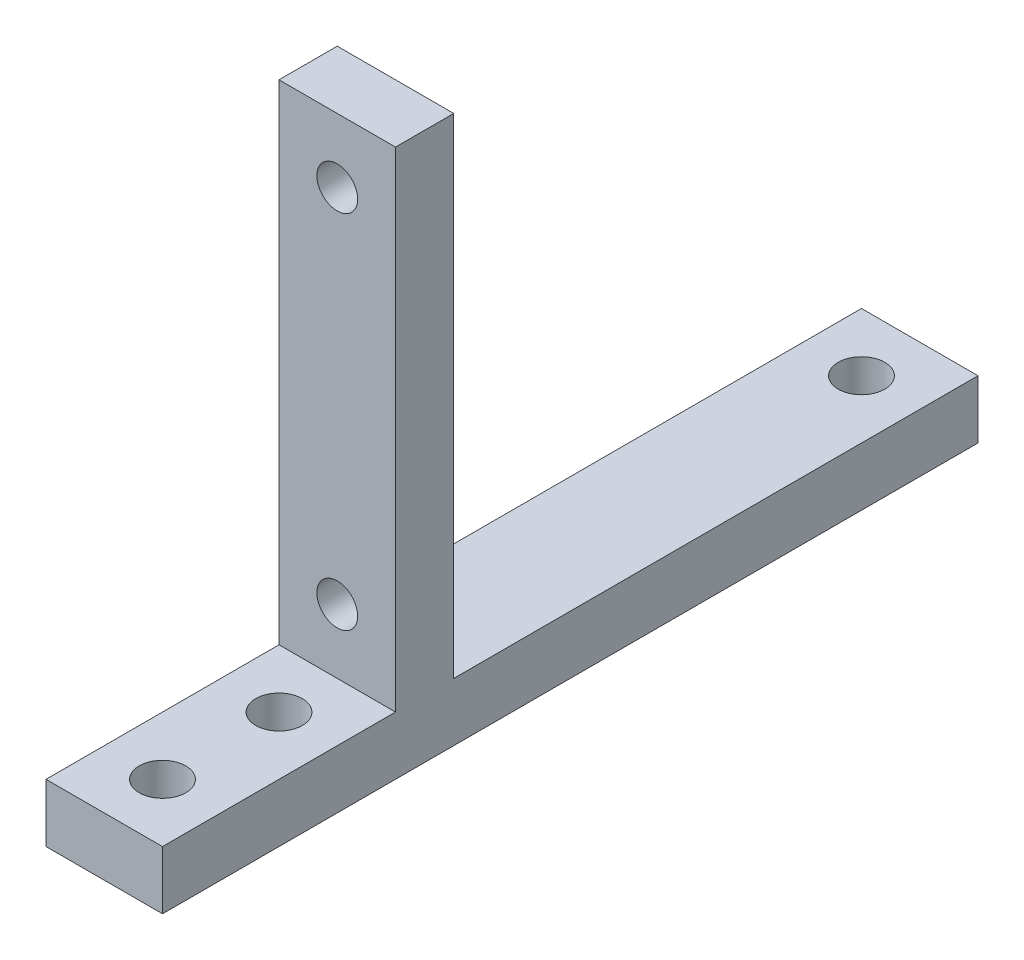
from build123d import *

# Parameters (mm, degrees)
ESBO_O1_W                = 10
ESBO_O1_H                = 42
ESBO_O1_R                = 1.75
RESSALTO_EXTRUS_O1_DEPTH = 5
ESBO_O2_W                = 10
ESBO_O2_H                = 70
ESBO_O2_R                = 2
RESSALTO_EXTRUS_O2_DEPTH = 5


with BuildPart() as part:
    # Esboço1 → Ressalto-extrusão1 (new body)
    with BuildSketch(Plane.XY):
        Rectangle(ESBO_O1_W, ESBO_O1_H)
        with Locations((0, 15.5)):
            Circle(ESBO_O1_R, mode=Mode.SUBTRACT)
        with Locations((0, -15.5)):
            Circle(ESBO_O1_R, mode=Mode.SUBTRACT)
    extrude(amount=RESSALTO_EXTRUS_O1_DEPTH)

    # Esboço2 → Ressalto-extrusão2 (add)
    with BuildSketch(Plane.XZ.offset(21)):
        with Locations((0, -10)):
            Rectangle(ESBO_O2_W, ESBO_O2_H)
        with Locations(Location((0, 20, 0), (0, 0, 270))):
            Circle(ESBO_O2_R, mode=Mode.SUBTRACT)
        with Locations(Location((0, -40, 0), (0, 0, 270))):
            Circle(ESBO_O2_R, mode=Mode.SUBTRACT)
        with Locations(Location((0, 10, 0), (0, 0, 270))):
            Circle(ESBO_O2_R, mode=Mode.SUBTRACT)
    extrude(amount=RESSALTO_EXTRUS_O2_DEPTH)


solid = part.part
